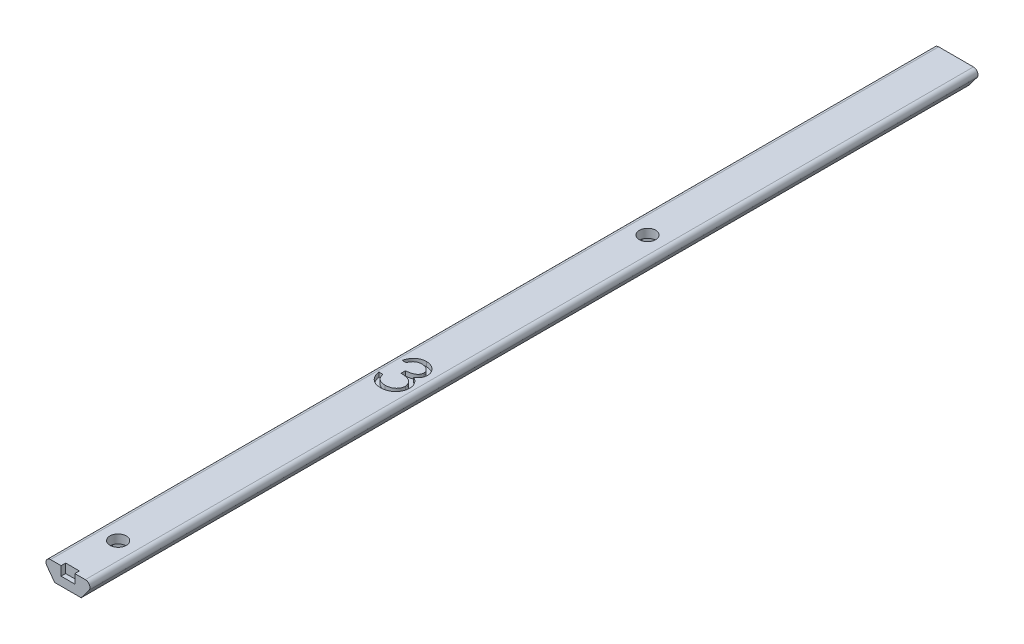
from build123d import *

# Parameters (mm, degrees)
BOSS_EXTRUDE1_DEPTH = 171.2
FILLET1_R           = 1
SKETCH2_R           = 1.8
CUT_EXTRUDE1_DEPTH  = 200
CUT_EXTRUDE2_DEPTH  = 2
LPATTERN1_COUNT     = 3
LPATTERN1_PITCH     = 116
CUT_EXTRUDE3_DEPTH  = 1
SKETCH5_W           = 10.598271306
SKETCH5_H           = 4.806690724
CUT_EXTRUDE4_DEPTH  = 16.6
SKETCH6_W           = 3
SKETCH6_H           = 2
CUT_EXTRUDE5_DEPTH  = 2
THICKEN1_T1         = 40


with BuildPart() as part:
    # Sketch1 → Boss-Extrude1 (new body)
    with BuildSketch(Plane.XY):
        Polygon((0, 0), (5.8, 0), (8.7, 3.9), (-2.9, 3.9), align=None)
    extrude(amount=BOSS_EXTRUDE1_DEPTH)

    # Fillet1
    fillet1_edges = [part.edges().sort_by_distance(p)[0] for p in [
        (-2.9, 3.9, 85.6),
        (8.7, 3.9, 85.6),
    ]]
    fillet(fillet1_edges, radius=FILLET1_R)

    # Sketch2 → Cut-Extrude1 (cut)
    with BuildSketch(Plane.XZ):
        with Locations(Location((2.9, 143.6, 0), (0, 0, 270))):
            Circle(SKETCH2_R)
    cut_extrude1 = extrude(amount=-CUT_EXTRUDE1_DEPTH, mode=Mode.SUBTRACT)

    # Sketch3 → Cut-Extrude2 (cut)
    with BuildSketch(Plane.XZ):
        Polygon((2.92874321, 146.948508199), (0.01447844, 145.29914645), (-0.014264771, 141.950638251), (2.87125679, 140.251491801), (5.78552156, 141.90085355), (5.814264771, 145.249361749), align=None)
    cut_extrude2 = extrude(amount=-CUT_EXTRUDE2_DEPTH, mode=Mode.SUBTRACT)

    # LPattern1: Cut-Extrude1, Cut-Extrude2 ×3
    with Locations(*[(0, 0, -i * LPATTERN1_PITCH) for i in range(1, LPATTERN1_COUNT)]):
        add(cut_extrude1, mode=Mode.SUBTRACT)
        add(cut_extrude2, mode=Mode.SUBTRACT)

    # Sketch4 → Cut-Extrude3 (cut)
    with BuildSketch(Plane(origin=(0, 3.9, 0), x_dir=(1, 0, 0), z_dir=(0, 1, 0))):
        with BuildLine():
            Line((0.677254142, -78.273076923), (-0.177553551, -78.273076923))
            add(Edge.make_bspline(
                [(-0.177553551, -78.273076923), (-0.154395416, -78.177194235), (-0.109123158, -77.989751421), (-0.01469619, -77.72194309), (0.088171783, -77.468514078), (0.211694989, -77.234209763), (0.346429527, -77.014321321), (0.500796362, -76.81383606), (0.667673607, -76.627655062), (0.852254362, -76.462428322), (1.045825934, -76.312810359), (1.251115864, -76.185243239), (1.463993881, -76.075503937), (1.685934908, -75.985097449), (1.917599703, -75.916992274), (2.156893893, -75.867579824), (2.404444561, -75.835491149), (2.572486218, -75.83235943), (2.657813036, -75.830769231)],
                knots=[0, 0, 0, 0, 1.162005537, 2.271625781, 3.343758855, 4.383309926, 5.390229558, 6.379919256, 7.361854164, 8.333198761, 9.295911338, 10.242430842, 11.177959212, 12.116337295, 13.062827104, 14.020064771, 14.994644689, 16, 16, 16, 16], degree=3))
            add(Edge.make_bspline(
                [(2.657813036, -75.830769231), (2.782135355, -75.834522707), (3.028068164, -75.841947786), (3.389373313, -75.909750646), (3.737789156, -76.017043327), (4.069502038, -76.165289685), (4.377617915, -76.348135158), (4.651764252, -76.565753478), (4.888225128, -76.813945863), (5.08660197, -77.088082341), (5.241927503, -77.381059121), (5.356462562, -77.682593834), (5.426190137, -77.991971199), (5.435226795, -78.200860651), (5.439754142, -78.305513822)],
                knots=[0, 0, 0, 0, 1.083050992, 2.142477498, 3.193116406, 4.255571735, 5.30263384, 6.308962982, 7.297363603, 8.282367274, 9.249857812, 10.179914175, 11.08814088, 12, 12, 12, 12], degree=3))
            add(Edge.make_bspline(
                [(5.439754142, -78.305513822), (5.436587512, -78.406225171), (5.430390908, -78.603301651), (5.37777561, -78.891015154), (5.289230494, -79.162182652), (5.166576355, -79.417945672), (5.007803993, -79.656682557), (4.815473296, -79.878930446), (4.588226767, -80.085675083), (4.416017657, -80.20411022), (4.32735931, -80.265084135)],
                knots=[0, 0, 0, 0, 1.024540389, 2.004866551, 2.965041327, 3.920577974, 4.882998113, 5.874504559, 6.905732034, 8, 8, 8, 8], degree=3))
            add(Edge.make_bspline(
                [(4.32735931, -80.265084135), (4.42868287, -80.314010444), (4.62943415, -80.410947615), (4.903075234, -80.601055069), (5.151481452, -80.820555557), (5.290012287, -80.991849491), (5.35961592, -81.077914663)],
                knots=[0, 0, 0, 0, 1.015518401, 2.012035669, 3.001164323, 4, 4, 4, 4], degree=3))
            add(Edge.make_bspline(
                [(5.35961592, -81.077914663), (5.405448431, -81.140664687), (5.496362912, -81.26513716), (5.608582472, -81.465261291), (5.710388704, -81.667603558), (5.789718944, -81.87758737), (5.85115211, -82.092778929), (5.895065169, -82.313547735), (5.922345153, -82.540074068), (5.926251905, -82.69332446), (5.92821568, -82.770357572)],
                knots=[0, 0, 0, 0, 1.025084078, 2.033381695, 3.024893161, 4.013698104, 4.991890475, 5.976764909, 6.982997093, 8, 8, 8, 8], degree=3))
            add(Edge.make_bspline(
                [(5.92821568, -82.770357572), (5.92333204, -82.903734028), (5.913587741, -83.169859267), (5.826490939, -83.563036902), (5.691472048, -83.947372019), (5.49972853, -84.314968546), (5.266046238, -84.658903726), (4.988032377, -84.966632824), (4.668845794, -85.231151883), (4.312867564, -85.452159718), (3.927194522, -85.628829206), (3.514692375, -85.751449818), (3.081304728, -85.83131286), (2.784104868, -85.839876839), (2.633008348, -85.844230769)],
                knots=[0, 0, 0, 0, 0.955779014, 1.907060117, 2.875433937, 3.871313158, 4.872415639, 5.851225146, 6.836215519, 7.83643374, 8.849228613, 9.86973379, 10.916971861, 12, 12, 12, 12], degree=3))
            add(Edge.make_bspline(
                [(2.633008348, -85.844230769), (2.531174395, -85.841867989), (2.330799134, -85.837218825), (2.036222185, -85.805436346), (1.75503956, -85.74738826), (1.486871083, -85.669274265), (1.231478519, -85.570236738), (0.989641205, -85.446905139), (0.75987128, -85.301821694), (0.544336992, -85.133273858), (0.343064032, -84.944729641), (0.161401262, -84.732841907), (-0.003680032, -84.501527543), (-0.147759642, -84.248099797), (-0.277400206, -83.975833776), (-0.384028381, -83.68124322), (-0.477878392, -83.366961703), (-0.52151232, -83.147947281), (-0.543899705, -83.035576923)],
                knots=[0, 0, 0, 0, 1.048658725, 2.063410685, 3.046034179, 4.001477787, 4.936774919, 5.862367409, 6.792675028, 7.730719943, 8.675894397, 9.627829632, 10.600096036, 11.597688215, 12.626045268, 13.701542398, 14.82072376, 16, 16, 16, 16], degree=3))
            Line((-0.543899705, -83.035576923), (0.310907988, -83.035576923))
            add(Edge.make_bspline(
                [(0.310907988, -83.035576923), (0.333178231, -83.108916738), (0.376495788, -83.251569048), (0.450230985, -83.456874451), (0.534236783, -83.645083153), (0.624355689, -83.817575792), (0.719002745, -83.976051116), (0.824906934, -84.116318631), (0.934224394, -84.244539288), (1.016627491, -84.316778554), (1.056956666, -84.352133413)],
                knots=[0, 0, 0, 0, 1.198163088, 2.33053128, 3.407730985, 4.417276592, 5.372219308, 6.28897303, 7.162600585, 8, 8, 8, 8], degree=3))
            add(Edge.make_bspline(
                [(1.056956666, -84.352133413), (1.110287349, -84.393249665), (1.216784096, -84.475355251), (1.390324782, -84.580134683), (1.572837079, -84.670924331), (1.768275585, -84.740276389), (1.972422925, -84.798998451), (2.188578826, -84.837426435), (2.414836267, -84.863792102), (2.56932568, -84.866118737), (2.648272771, -84.867307692)],
                knots=[0, 0, 0, 0, 0.946170439, 1.889420265, 2.845303464, 3.807233317, 4.801018734, 5.828864929, 6.890507805, 8, 8, 8, 8], degree=3))
            add(Edge.make_bspline(
                [(2.648272771, -84.867307692), (2.737409089, -84.86563155), (2.911707464, -84.862353999), (3.166038188, -84.832212254), (3.407993456, -84.788314486), (3.634886919, -84.720515583), (3.849690657, -84.636747694), (4.049393574, -84.531568819), (4.236617263, -84.408166398), (4.408963717, -84.267906259), (4.563936848, -84.114359191), (4.700387952, -83.953759333), (4.816387923, -83.786783825), (4.909960376, -83.612508653), (4.983848659, -83.431655495), (5.034149369, -83.243716823), (5.069123849, -83.050230692), (5.07197213, -82.918706855), (5.073407988, -82.852403846)],
                knots=[0, 0, 0, 0, 1.217147791, 2.380027433, 3.494444702, 4.572153297, 5.609568379, 6.639424714, 7.649109417, 8.668170816, 9.669597737, 10.625200337, 11.543417969, 12.441394052, 13.322311151, 14.205496177, 15.095365482, 16, 16, 16, 16], degree=3))
            add(Edge.make_bspline(
                [(5.073407988, -82.852403846), (5.069243381, -82.763654417), (5.060934891, -82.586597163), (4.997502257, -82.326108621), (4.893165777, -82.075129192), (4.747099871, -81.837940935), (4.569293352, -81.618115088), (4.361471713, -81.421977697), (4.121909177, -81.260134092), (3.901419391, -81.148314248), (3.706115643, -81.072013351), (3.538978061, -81.021190769), (3.351861877, -80.978155035), (3.147029884, -80.938116639), (2.922938702, -80.904040684), (2.679832296, -80.875624028), (2.417661402, -80.852886381), (2.236166158, -80.842732472), (2.142638757, -80.8375)],
                knots=[0, 0, 0, 0, 1.07054697, 2.135767047, 3.216561865, 4.33974944, 5.486079747, 6.621378074, 7.775625952, 8.963672916, 9.598146892, 10.304877434, 11.070270905, 11.915000392, 12.823868403, 13.805723172, 14.86925407, 16, 16, 16, 16], degree=3))
            Line((2.142638757, -80.8375), (2.142638757, -79.860576923))
            add(Edge.make_bspline(
                [(2.142638757, -79.860576923), (2.260479787, -79.858577207), (2.491301415, -79.854660255), (2.828470916, -79.807285598), (3.150887573, -79.741751889), (3.451406063, -79.641371473), (3.725314348, -79.524784665), (3.962948408, -79.389115438), (4.160979001, -79.238308156), (4.318443774, -79.070035126), (4.436905461, -78.889563461), (4.523519817, -78.701467414), (4.574683562, -78.504098363), (4.581513441, -78.369402159), (4.584946449, -78.301697716)],
                knots=[0, 0, 0, 0, 1.321986639, 2.589447074, 3.816329219, 5.01088745, 6.139805852, 7.153945165, 8.075214402, 8.924034688, 9.728124013, 10.488707548, 11.240355623, 12, 12, 12, 12], degree=3))
            add(Edge.make_bspline(
                [(4.584946449, -78.301697716), (4.583818659, -78.251956138), (4.581574975, -78.152997628), (4.553279526, -78.008421549), (4.510759815, -77.868265403), (4.452304266, -77.733125219), (4.374062653, -77.60393826), (4.280429219, -77.479603131), (4.16893746, -77.360829704), (4.041178779, -77.25012112), (3.903986653, -77.14461341), (3.753628337, -77.055041298), (3.594637377, -76.978446522), (3.426837753, -76.91528352), (3.249684916, -76.867769314), (3.064011213, -76.833653917), (2.869462589, -76.812324299), (2.736733804, -76.809253396), (2.669261353, -76.807692308)],
                knots=[0, 0, 0, 0, 0.884392785, 1.759457502, 2.611959086, 3.489218968, 4.37281399, 5.2945488, 6.255912374, 7.266815255, 8.301784654, 9.332968512, 10.37626691, 11.440494194, 12.520033166, 13.637162961, 14.798855837, 16, 16, 16, 16], degree=3))
            add(Edge.make_bspline(
                [(2.669261353, -76.807692308), (2.560807885, -76.8114788), (2.348973038, -76.8188747), (2.043588157, -76.883652901), (1.759690541, -76.987007543), (1.542687455, -77.110378117), (1.382442736, -77.232163226), (1.267933354, -77.338523149), (1.155482536, -77.456722476), (1.05248823, -77.59404134), (0.948328336, -77.741180248), (0.853501351, -77.905618981), (0.761354617, -78.083068083), (0.705830536, -78.20851406), (0.677254142, -78.273076923)],
                knots=[0, 0, 0, 0, 1.472543308, 2.876219568, 4.221790263, 5.565193594, 6.249813518, 6.953379497, 7.687249741, 8.463570142, 9.283606569, 10.136032583, 11.040678096, 12, 12, 12, 12], degree=3))
        make_face()
    extrude(amount=-CUT_EXTRUDE3_DEPTH, mode=Mode.SUBTRACT)

    # Sketch5 → Cut-Extrude4 (cut)
    with BuildSketch(Plane.XY.offset(171.2)):
        with Locations((3.01775857, 2.046347921)):
            Rectangle(SKETCH5_W, SKETCH5_H)
    extrude(amount=-CUT_EXTRUDE4_DEPTH, mode=Mode.SUBTRACT)

    # Sketch6 → Cut-Extrude5 (cut)
    with BuildSketch(Plane(origin=(0, 3.9, 0), x_dir=(1, 0, 0), z_dir=(0, 1, 0))):
        with Locations((2.9, -154.6)):
            Rectangle(SKETCH6_W, SKETCH6_H)
    extrude(amount=-CUT_EXTRUDE5_DEPTH, mode=Mode.SUBTRACT)

    # Surface-Offset1: a surface, a copy of 1 face of the part
    surface_offset1_1 = part.part.faces().sort_by_distance((2.9, 2.093393293, 0))[0]
    add(Solid.thicken(surface_offset1_1, THICKEN1_T1))


solid = part.part
